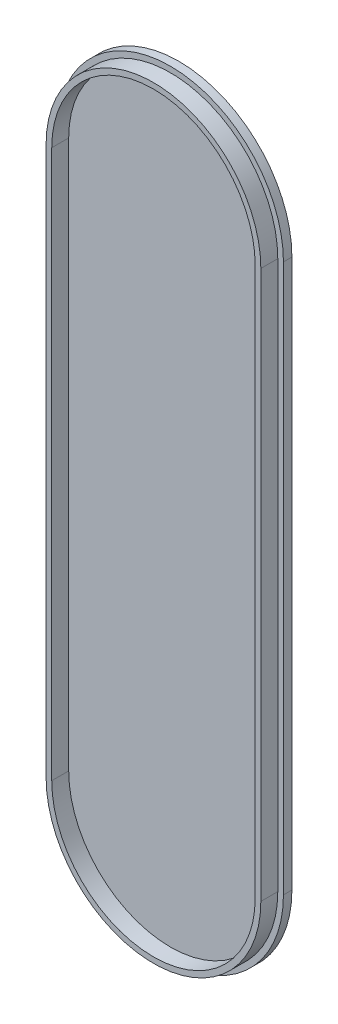
from build123d import *

# Parameters (mm, degrees)
BOSS_EXTRUDE1_DEPTH = 1.5
BOSS_EXTRUDE2_DEPTH = 3


with BuildPart() as part:
    # Sketch3 → Boss-Extrude1 (new body)
    with BuildSketch(Plane.XY):
        with BuildLine():
            Line((-20, 0), (-20, -97))
            ThreePointArc((-20, -97), (0, -117), (20, -97))
            Line((20, -97), (20, 0))
            ThreePointArc((20, 0), (0, 20), (-20, 0))
        make_face()
    extrude(amount=BOSS_EXTRUDE1_DEPTH)

    # Sketch5 → Boss-Extrude2 (add)
    with BuildSketch(Plane.XY.offset(1.5)):
        with BuildLine():
            Line((-19, 0), (-19, -97))
            ThreePointArc((-19, -97), (0, -116), (19, -97))
            Line((19, -97), (19, 0))
            ThreePointArc((19, 0), (0, 19), (-19, 0))
        make_face()
        with BuildLine():
            Line((-18, 0), (-18, -97))
            ThreePointArc((-18, -97), (0, -115), (18, -97))
            Line((18, -97), (18, 0))
            ThreePointArc((18, 0), (0, 18), (-18, 0))
        make_face(mode=Mode.SUBTRACT)
    extrude(amount=BOSS_EXTRUDE2_DEPTH)


solid = part.part
